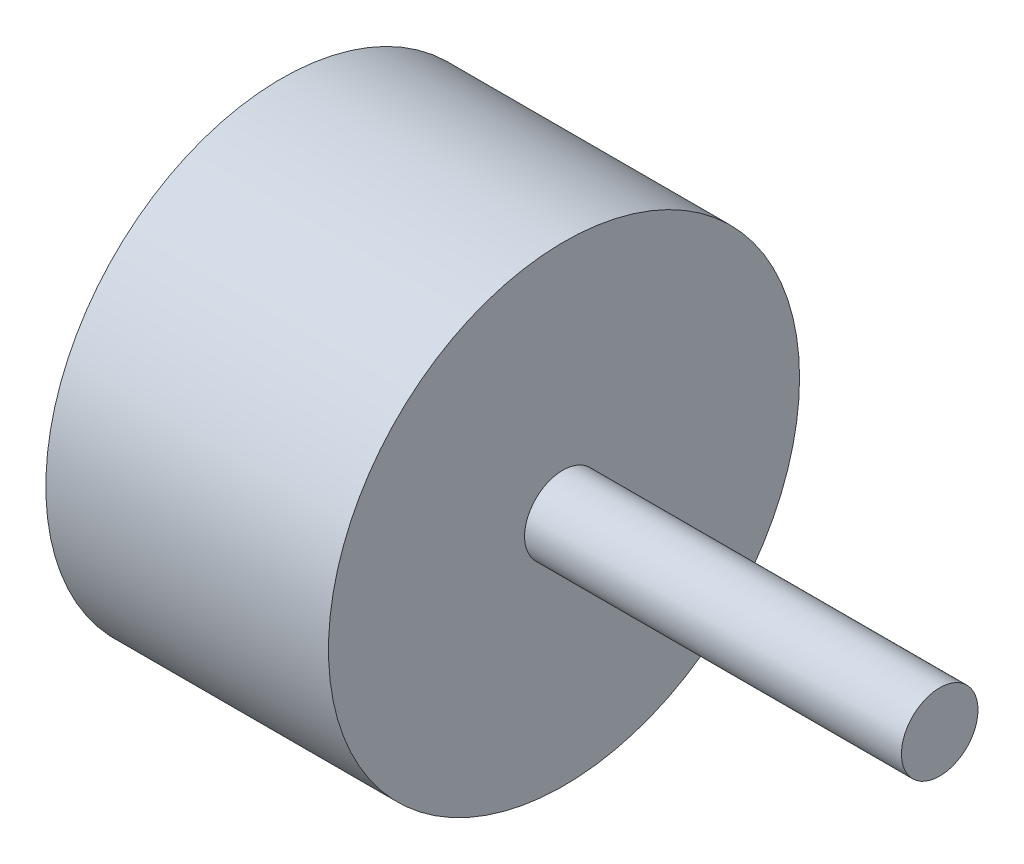
from build123d import *

# Parameters (mm, degrees)
SKETCH1_R           = 250
BOSS_EXTRUDE1_DEPTH = 300
SKETCH2_R           = 40.626061148
BOSS_EXTRUDE3_DEPTH = 400


with BuildPart() as part:
    # Sketch1 → Boss-Extrude1 (new body)
    with BuildSketch(Plane(origin=(0, 0, 0), x_dir=(0, 0, -1), z_dir=(1, 0, 0))):
        with Locations((1.228114887, 0)):
            Circle(SKETCH1_R)
    extrude(amount=BOSS_EXTRUDE1_DEPTH)

    # Sketch2 → Boss-Extrude3 (add)
    with BuildSketch(Plane(origin=(300, 0, 0), x_dir=(0, 0, -1), z_dir=(1, 0, 0))):
        Circle(SKETCH2_R)
    extrude(amount=BOSS_EXTRUDE3_DEPTH)


solid = part.part
